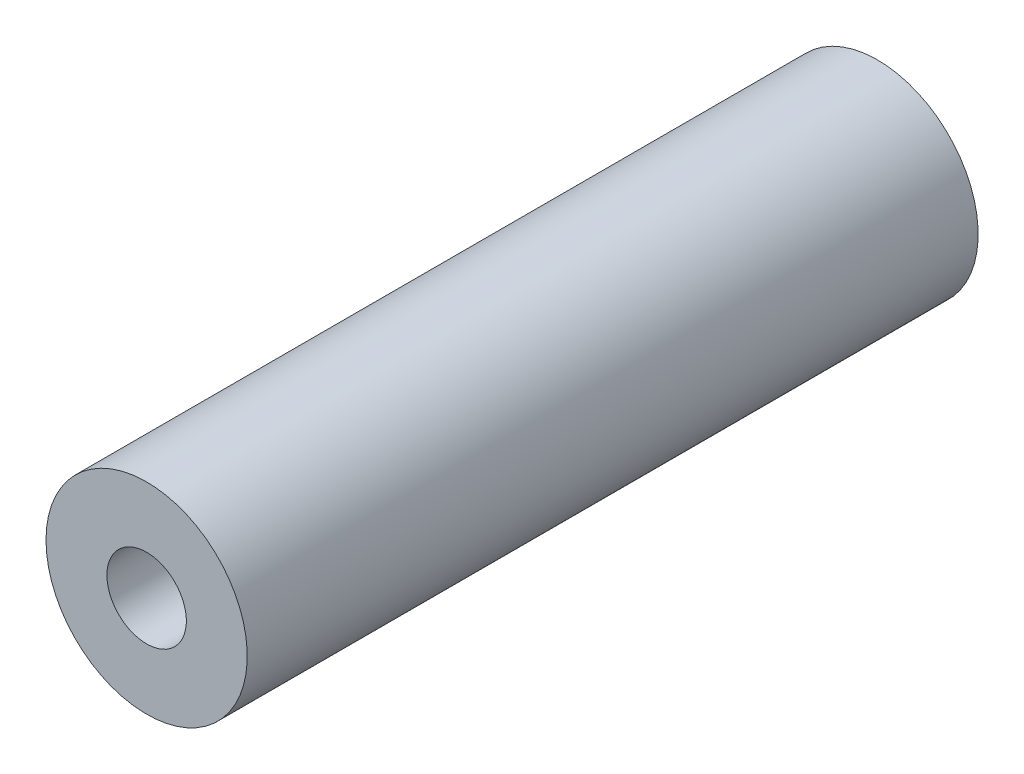
from build123d import *

# Parameters (mm, degrees)
SKETCH1_R           = 5.2451
SKETCH1_R_2         = 2.0701
BOSS_EXTRUDE1_DEPTH = 38.1


with BuildPart() as part:
    # Sketch1 → Boss-Extrude1 (new body)
    with BuildSketch(Plane.XY):
        with Locations(Location((0, 0, 0), (0, 0, 180))):
            Circle(SKETCH1_R)
        with Locations(Location((0, 0, 0), (0, 0, 180))):
            Circle(SKETCH1_R_2, mode=Mode.SUBTRACT)
    extrude(amount=BOSS_EXTRUDE1_DEPTH)


solid = part.part
